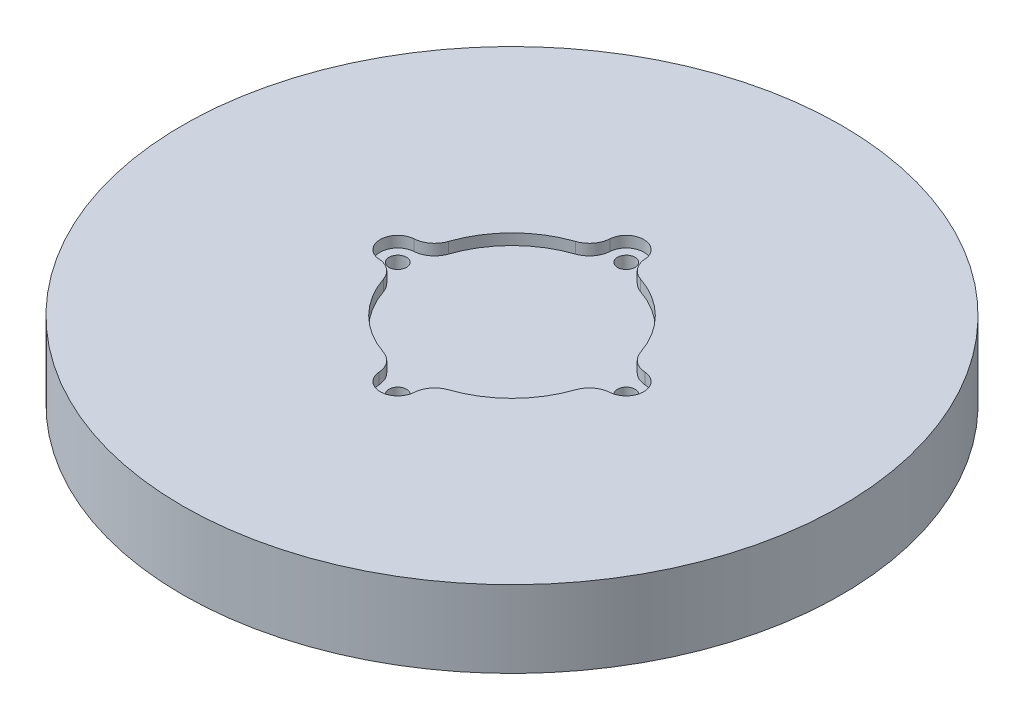
from build123d import *

# Parameters (mm, degrees)
SKETCH1_R           = 150
BOSS_EXTRUDE1_DEPTH = 35
SKETCH2_R           = 4
CUT_EXTRUDE1_DEPTH  = 30
SKETCH3_R           = 8
SKETCH3_R_2         = 46.138899257
CUT_EXTRUDE2_DEPTH  = 5
FILLET1_R           = 10


with BuildPart() as part:
    # Sketch1 → Boss-Extrude1 (new body)
    with BuildSketch(Plane(origin=(0, 0, 0), x_dir=(1, 0, 0), z_dir=(0, 1, 0))):
        with Locations(Location((0, 0, 0), (0, 0, 270))):
            Circle(SKETCH1_R)
    extrude(amount=BOSS_EXTRUDE1_DEPTH)

    # Sketch2 → Cut-Extrude1 (cut)
    with BuildSketch(Plane.XZ):
        with Locations(Location((0, 52, 0), (0, 0, 270))):
            Circle(SKETCH2_R)
        with Locations(Location((-52, 0, 0), (0, 0, 270))):
            Circle(SKETCH2_R)
        with Locations(Location((52, 0, 0), (0, 0, 270))):
            Circle(SKETCH2_R)
        with Locations(Location((0, -52, 0), (0, 0, 270))):
            Circle(SKETCH2_R)
    extrude(amount=-CUT_EXTRUDE1_DEPTH, mode=Mode.SUBTRACT)

    # Sketch3 → Cut-Extrude2 (cut)
    with BuildSketch(Plane(origin=(0, 35, 0), x_dir=(1, 0, 0), z_dir=(0, 1, 0))):
        with BuildLine():
            ThreePointArc((-52, 8), (-60, 0), (-52, -8))
            ThreePointArc((-52, -8), (-48.606472063, -7.244581985), (-45.85382716, -5.120992035))
            ThreePointArc((-45.85382716, -5.120992035), (-46.138899257, 0), (-45.85382716, 5.120992035))
            ThreePointArc((-45.85382716, 5.120992035), (-48.606472063, 7.244581985), (-52, 8))
        make_face()
        with BuildLine():
            Line((-52, -8), (-45.440048687, -8))
            ThreePointArc((-45.440048687, -8), (-45.669630101, -6.563757396), (-45.85382716, -5.120992035))
            ThreePointArc((-45.85382716, -5.120992035), (-48.606472063, -7.244581985), (-52, -8))
        make_face()
        with BuildLine():
            Line((-45.440048687, 8), (-52, 8))
            ThreePointArc((-52, 8), (-48.606472063, 7.244581985), (-45.85382716, 5.120992035))
            ThreePointArc((-45.85382716, 5.120992035), (-45.669630101, 6.563757396), (-45.440048687, 8))
        make_face()
        with Locations((0, 52)):
            Circle(SKETCH3_R)
        Circle(SKETCH3_R_2)
        with Locations((-52, 0)):
            Circle(SKETCH3_R)
        with Locations((0, -52)):
            Circle(SKETCH3_R)
        with Locations((52, 0)):
            Circle(SKETCH3_R)
        with BuildLine():
            ThreePointArc((5.120992035, 45.85382716), (7.244581985, 48.606472063), (8, 52))
            ThreePointArc((8, 52), (0, 60), (-8, 52))
            ThreePointArc((-8, 52), (-7.244581985, 48.606472063), (-5.120992035, 45.85382716))
            ThreePointArc((-5.120992035, 45.85382716), (0, 46.138899257), (5.120992035, 45.85382716))
        make_face()
        with BuildLine():
            ThreePointArc((5.120992035, 45.85382716), (6.563757396, 45.669630101), (8, 45.440048687))
            Line((8, 45.440048687), (8, 52))
            ThreePointArc((8, 52), (7.244581985, 48.606472063), (5.120992035, 45.85382716))
        make_face()
        with BuildLine():
            ThreePointArc((-5.120992035, 45.85382716), (-7.244581985, 48.606472063), (-8, 52))
            Line((-8, 52), (-8, 45.440048687))
            ThreePointArc((-8, 45.440048687), (-6.563757396, 45.669630101), (-5.120992035, 45.85382716))
        make_face()
        with BuildLine():
            ThreePointArc((45.85382716, -5.120992035), (48.606472063, -7.244581985), (52, -8))
            ThreePointArc((52, -8), (57.656854249, -5.656854249), (60, 0))
            ThreePointArc((60, 0), (57.656854249, 5.656854249), (52, 8))
            ThreePointArc((52, 8), (48.606472063, 7.244581985), (45.85382716, 5.120992035))
            ThreePointArc((45.85382716, 5.120992035), (46.067576106, 2.564460252), (46.138899257, 0))
            ThreePointArc((46.138899257, 0), (46.067576106, -2.564460252), (45.85382716, -5.120992035))
        make_face()
        with BuildLine():
            Line((45.440048687, -8), (52, -8))
            ThreePointArc((52, -8), (48.606472063, -7.244581985), (45.85382716, -5.120992035))
            ThreePointArc((45.85382716, -5.120992035), (45.669630101, -6.563757396), (45.440048687, -8))
        make_face()
        with BuildLine():
            ThreePointArc((45.85382716, 5.120992035), (48.606472063, 7.244581985), (52, 8))
            Line((52, 8), (45.440048687, 8))
            ThreePointArc((45.440048687, 8), (45.669630101, 6.563757396), (45.85382716, 5.120992035))
        make_face()
        with BuildLine():
            ThreePointArc((-8, -52), (0, -60), (8, -52))
            ThreePointArc((8, -52), (7.244581985, -48.606472063), (5.120992035, -45.85382716))
            ThreePointArc((5.120992035, -45.85382716), (0, -46.138899257), (-5.120992035, -45.85382716))
            ThreePointArc((-5.120992035, -45.85382716), (-7.244581985, -48.606472063), (-8, -52))
        make_face()
        with BuildLine():
            Line((-8, -45.440048687), (-8, -52))
            ThreePointArc((-8, -52), (-7.244581985, -48.606472063), (-5.120992035, -45.85382716))
            ThreePointArc((-5.120992035, -45.85382716), (-6.563757396, -45.669630101), (-8, -45.440048687))
        make_face()
        with BuildLine():
            Line((8, -52), (8, -45.440048687))
            ThreePointArc((8, -45.440048687), (6.563757396, -45.669630101), (5.120992035, -45.85382716))
            ThreePointArc((5.120992035, -45.85382716), (7.244581985, -48.606472063), (8, -52))
        make_face()
    extrude(amount=-CUT_EXTRUDE2_DEPTH, mode=Mode.SUBTRACT)

    # Fillet1
    fillet1_edges = [part.edges().sort_by_distance(p)[0] for p in [
        (-45.440048687, 32.5, 8),
        (-8, 32.5, 45.440048687),
        (8, 32.5, 45.440048687),
        (45.440048687, 32.5, 8),
        (45.440048687, 32.5, -8),
        (8, 32.5, -45.440048687),
        (-8, 32.5, -45.440048687),
        (-45.440048687, 32.5, -8),
    ]]
    fillet(fillet1_edges, radius=FILLET1_R)


solid = part.part
